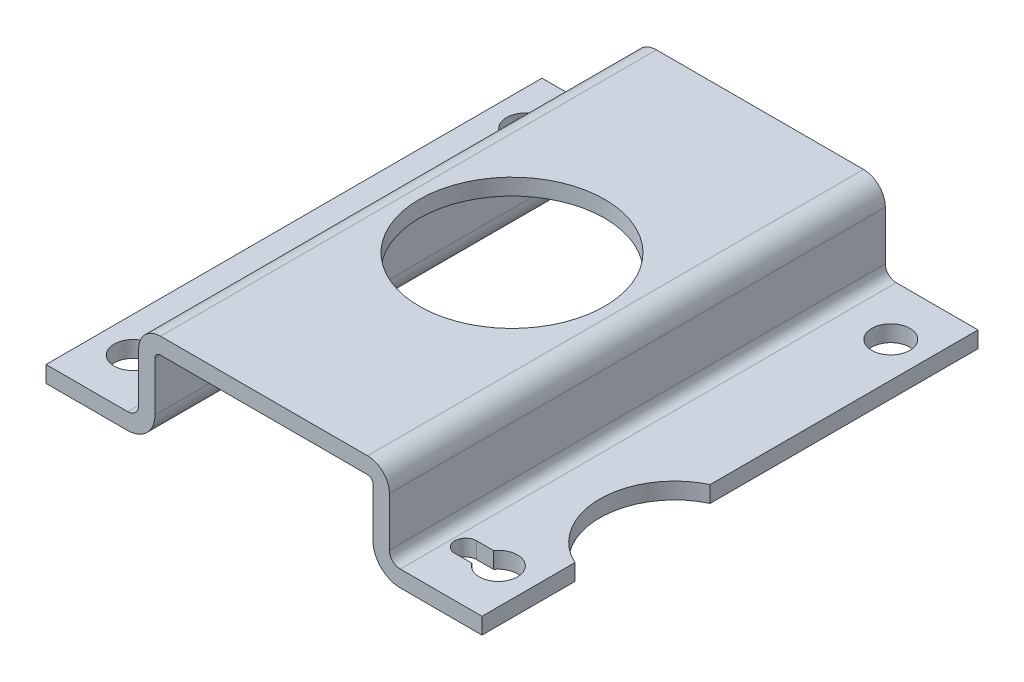
from build123d import *

# Parameters (mm, degrees)
EXTRUDE_1_DEPTH     = 45.5
FILLET_1_R          = 4
FILLET_2_R          = 1
FILLET_3_R          = 5
FILLET_4_R          = 2
SKETCH_2_R          = 3.5
CUT_EXTRUDE_1_DEPTH = 10
SKETCH_3_R          = 13.760875338
CUT_EXTRUDE_2_DEPTH = 10
SKETCH_4_R          = 17
CUT_EXTRUDE_3_DEPTH = 10


with BuildPart() as part:
    # 草图1 → 凸台-拉伸1 (new, symmetric)
    with BuildSketch(Plane.XY):
        Polygon((0, 18), (-23, 18), (-23, 3), (-40, 3), (-40, 0), (-20, 0), (-20, 15), (0, 15), (20, 15), (20, 0), (40, 0), (40, 3), (23, 3), (23, 18), align=None)
    extrude(amount=EXTRUDE_1_DEPTH, both=True)

    # 圆角1
    fillet_1_edges = [part.edges().sort_by_distance(p)[0] for p in [
        (-23, 18, 0),
        (23, 18, 0),
    ]]
    fillet(fillet_1_edges, radius=FILLET_1_R)

    # 圆角2
    fillet_2_edges = [part.edges().sort_by_distance(p)[0] for p in [
        (-20, 15, 0),
        (20, 15, 0),
    ]]
    fillet(fillet_2_edges, radius=FILLET_2_R)

    # 圆角3
    fillet_3_edges = [part.edges().sort_by_distance(p)[0] for p in [
        (-20, 0, 0),
        (20, 0, 0),
    ]]
    fillet(fillet_3_edges, radius=FILLET_3_R)

    # 圆角4
    fillet_4_edges = [part.edges().sort_by_distance(p)[0] for p in [
        (-23, 3, 0),
        (23, 3, 0),
    ]]
    fillet(fillet_4_edges, radius=FILLET_4_R)

    # 草图2 → 切除-拉伸1 (cut)
    with BuildSketch(Plane.XZ):
        with Locations(Location((-33.5, -36, 0), (0, 0, 270))):
            Circle(SKETCH_2_R)
        with Locations(Location((33.5, -36, 0), (0, 0, 270))):
            Circle(SKETCH_2_R)
        with BuildLine():
            Line((-27.5, 38), (-30.627718677, 38))
            ThreePointArc((-30.627718677, 38), (-37, 36), (-30.627718677, 34))
            Line((-30.627718677, 34), (-27.5, 34))
            ThreePointArc((-27.5, 34), (-25.5, 36), (-27.5, 38))
        make_face()
        with BuildLine():
            Line((27.5, 34), (30.627718677, 34))
            ThreePointArc((30.627718677, 34), (37, 36), (30.627718677, 38))
            Line((30.627718677, 38), (27.5, 38))
            ThreePointArc((27.5, 38), (25.5, 36), (27.5, 34))
        make_face()
    extrude(amount=-CUT_EXTRUDE_1_DEPTH, mode=Mode.SUBTRACT)

    # 草图3 → 切除-拉伸2 (cut)
    with BuildSketch(Plane.XZ):
        with Locations((45.925407616, 16.065733646)):
            Circle(SKETCH_3_R)
    extrude(amount=-CUT_EXTRUDE_2_DEPTH, mode=Mode.SUBTRACT)

    # 草图4 → 切除-拉伸3 (cut)
    with BuildSketch(Plane(origin=(0, 18, 0), x_dir=(1, 0, 0), z_dir=(0, 1, 0))):
        with Locations(Location((0, 0, 0), (0, 0, 180))):
            Circle(SKETCH_4_R)
    extrude(amount=-CUT_EXTRUDE_3_DEPTH, mode=Mode.SUBTRACT)


solid = part.part
